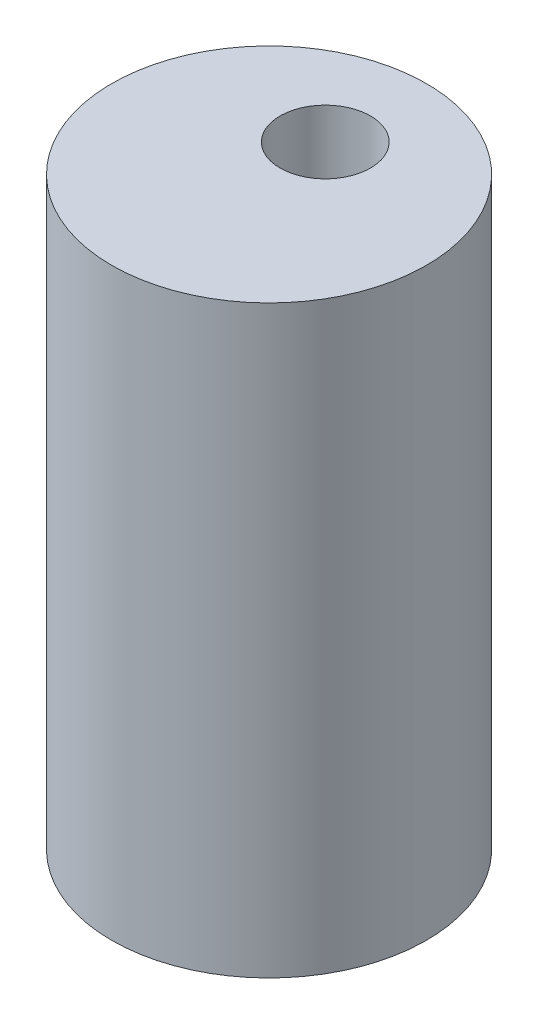
from build123d import *

# Parameters (mm, degrees)
SKETCH1_R                   = 8.89
BOSS_EXTRUDE1_DEPTH         = 33.02
F_1_4_20_TAPPED_HOLE1_D     = 5.1054
F_1_4_20_TAPPED_HOLE1_DEPTH = 12.7
F_1_4_20_TAPPED_HOLE1_TIP   = 1.533816902
F_6_0MM_DOWEL_HOLE1_D       = 6
F_6_0MM_DOWEL_HOLE1_DEPTH   = 17.9999894
F_6_0MM_DOWEL_HOLE1_TIP     = 1.802581857
M4X0_7_TAPPED_HOLE1_REACH   = 40.542
M4X0_7_TAPPED_HOLE1_BORE_R  = 1.65


with BuildPart() as part:
    # Sketch1 → Boss-Extrude1 (new body)
    with BuildSketch(Plane(origin=(0, 0, 0), x_dir=(1, 0, 0), z_dir=(0, 1, 0))):
        with Locations(Location((0, 0, 0), (0, 0, 270))):
            Circle(SKETCH1_R)
    extrude(amount=BOSS_EXTRUDE1_DEPTH)

    # 1/4-20 Tapped Hole1
    with Locations(Plane(origin=(0, 33.02, 0), x_dir=(1, 0, 0), z_dir=(0, 1, 0))):
        with Locations((0, 3.175)):
            Hole(F_1_4_20_TAPPED_HOLE1_D / 2, depth=F_1_4_20_TAPPED_HOLE1_DEPTH)
            with Locations((0, 0, -(F_1_4_20_TAPPED_HOLE1_DEPTH + F_1_4_20_TAPPED_HOLE1_TIP / 2))):  # 118° drill point
                Cone(0, F_1_4_20_TAPPED_HOLE1_D / 2, F_1_4_20_TAPPED_HOLE1_TIP, mode=Mode.SUBTRACT)

    # Ø6.0mm Dowel Hole1
    with Locations(Plane(origin=(0, 0, 0), x_dir=(-1, 0, 0), z_dir=(0, -1, 0))):
        with Locations((0, 0)):
            Hole(F_6_0MM_DOWEL_HOLE1_D / 2, depth=F_6_0MM_DOWEL_HOLE1_DEPTH)
            with Locations((0, 0, -(F_6_0MM_DOWEL_HOLE1_DEPTH + F_6_0MM_DOWEL_HOLE1_TIP / 2))):  # 118° drill point
                Cone(0, F_6_0MM_DOWEL_HOLE1_D / 2, F_6_0MM_DOWEL_HOLE1_TIP, mode=Mode.SUBTRACT)

    # M4x0.7 Tapped Hole1 bore → M4x0.7 Tapped Hole1 (cut, up to next)
    with BuildSketch(Plane(origin=(0, 0, -8.89), x_dir=(-1, 0, 0), z_dir=(0, 0, -1)), mode=Mode.PRIVATE) as m4x0_7_tapped_hole1_sk1:
        with Locations((0, 10)):
            Circle(M4X0_7_TAPPED_HOLE1_BORE_R)
    m4x0_7_tapped_hole1_tool1 = extrude(m4x0_7_tapped_hole1_sk1.sketch, amount=-M4X0_7_TAPPED_HOLE1_REACH, mode=Mode.PRIVATE) & part.part
    add(m4x0_7_tapped_hole1_tool1.solids().sort_by_distance((0, 10, -8.89))[0], mode=Mode.SUBTRACT)


solid = part.part
